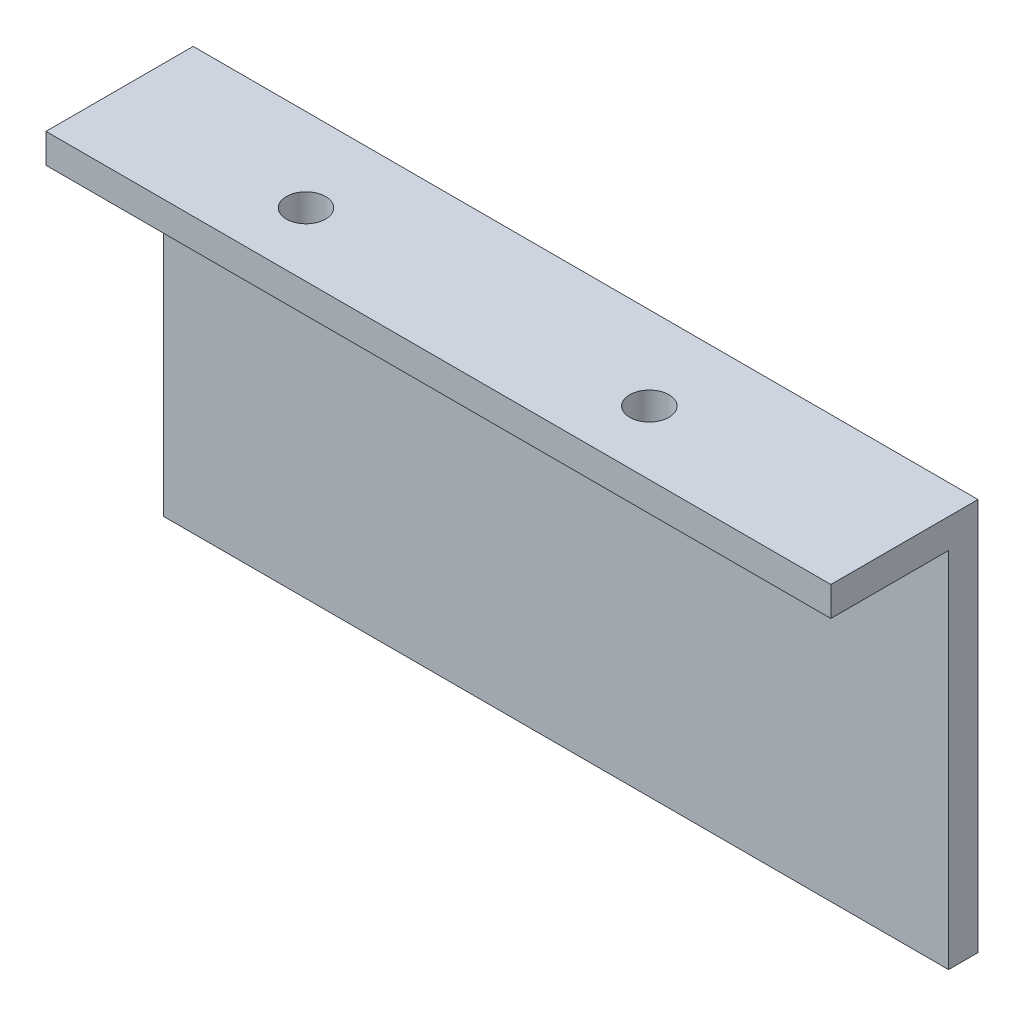
from build123d import *

# Parameters (mm, degrees)
SKETCH1_W           = 80
SKETCH1_H           = 40
BOSS_EXTRUDE1_DEPTH = 3
SKETCH2_W           = 80
SKETCH2_H           = 3
BOSS_EXTRUDE2_DEPTH = 12
SKETCH3_R           = 2
CUT_EXTRUDE1_DEPTH  = 12


with BuildPart() as part:
    # Sketch1 → Boss-Extrude1 (new body)
    with BuildSketch(Plane.XY):
        Rectangle(SKETCH1_W, SKETCH1_H)
    extrude(amount=BOSS_EXTRUDE1_DEPTH)

    # Sketch2 → Boss-Extrude2 (add)
    with BuildSketch(Plane.XY.offset(3)):
        with Locations((0, 18.5)):
            Rectangle(SKETCH2_W, SKETCH2_H)
    extrude(amount=BOSS_EXTRUDE2_DEPTH)

    # Sketch3 → Cut-Extrude1 (cut)
    with BuildSketch(Plane(origin=(0, 20, 0), x_dir=(1, 0, 0), z_dir=(0, 1, 0))):
        with Locations(Location((15, -8.5, 0), (0, 0, 270))):
            Circle(SKETCH3_R)
        with Locations(Location((-20, -8.5, 0), (0, 0, 270))):
            Circle(SKETCH3_R)
    extrude(amount=-CUT_EXTRUDE1_DEPTH, mode=Mode.SUBTRACT)


solid = part.part
